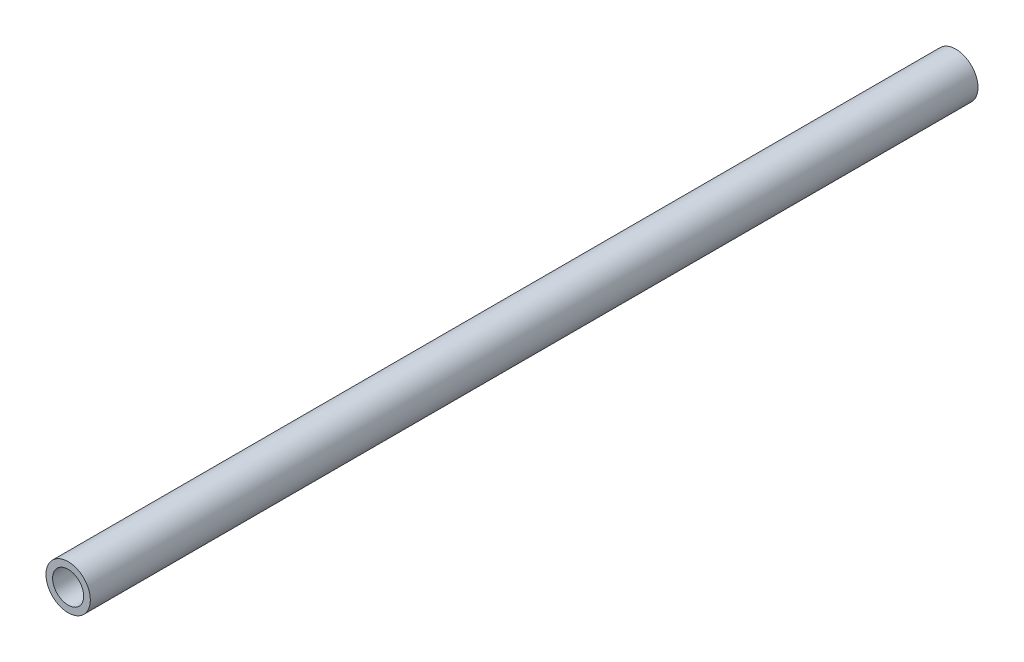
from build123d import *

# Parameters (mm, degrees)
SKETCH1_R           = 5
SKETCH1_R_2         = 3.5
BOSS_EXTRUDE1_DEPTH = 200


with BuildPart() as part:
    # Sketch1 → Boss-Extrude1 (new body)
    with BuildSketch(Plane.XY):
        Circle(SKETCH1_R)
        Circle(SKETCH1_R_2, mode=Mode.SUBTRACT)
    extrude(amount=BOSS_EXTRUDE1_DEPTH)


solid = part.part
